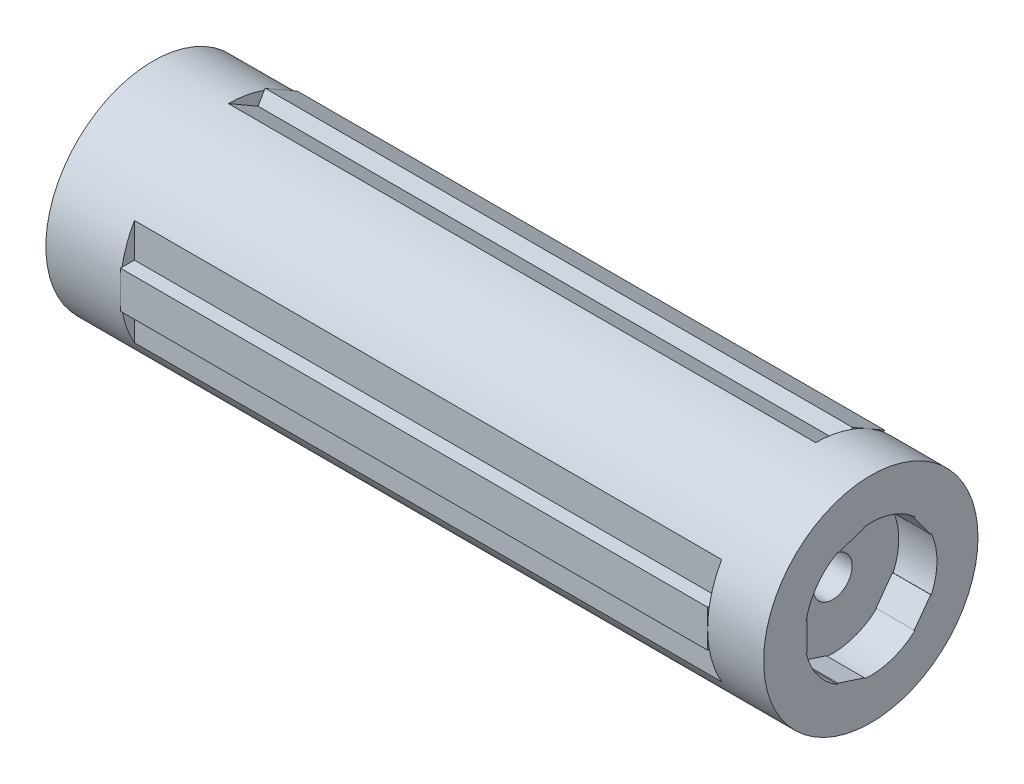
from build123d import *

# Parameters (mm, degrees)
SKIZZE1_R                       = 11.5
AUFSATZ_LINEAR_AUSTRAGEN1_DEPTH = 77
SCHNITT_LINEAR_AUSTRAGEN1_DEPTH = 4.1
SKIZZE3_R                       = 2.1
SCHNITT_LINEAR_AUSTRAGEN2_DEPTH = 3
SKIZZE4_R                       = 9.6
SCHNITT_LINEAR_AUSTRAGEN3_DEPTH = 12.75
SCHNITT_LINEAR_START            = -6
SKIZZE7_W                       = 1.5
SKIZZE7_H                       = 15
SCHNITT_LINEAR_AUSTRAGEN4_DEPTH = 63
SKIZZE8_W                       = 63
SKIZZE8_H                       = 4
AUFSATZ_LINEAR_AUSTRAGEN2_DEPTH = 1.5
SCHNITT_LINEAR_AUSTRAGEN6_DEPTH = 13.5
SKIZZE12_R                      = 3
SCHNITT_LINEAR_AUSTRAGEN7_DEPTH = 2
KREISMUSTER3_COUNT              = 3
SKIZZE13_R                      = 8.5
SCHNITT_LINEAR_AUSTRAGEN8_DEPTH = 40


with BuildPart() as part:
    # Skizze1 → Aufsatz-Linear austragen1 (new body)
    with BuildSketch(Plane(origin=(0, 0, 0), x_dir=(0, 0, -1), z_dir=(1, 0, 0))):
        Circle(SKIZZE1_R)
    extrude(amount=AUFSATZ_LINEAR_AUSTRAGEN1_DEPTH)

    # Skizze2 → Schnitt-Linear austragen1 (cut)
    with BuildSketch(Plane(origin=(77, 0, 0), x_dir=(0, 0, -1), z_dir=(1, 0, 0))):
        with BuildLine():
            Line((-6.942668977, 1.486387391), (-6.842668977, 1.486387391))
            Line((-6.842668977, 1.486387391), (-6.842668977, -1.513612609))
            Line((-6.842668977, -1.513612609), (-6.936784332, -1.513612609))
            ThreePointArc((-6.936784332, -1.513612609), (-5.735823545, -4.184534414), (-3.559041115, -6.143551607))
            Line((-3.559041115, -6.143551607), (-3.528139415, -6.048445955))
            Line((-3.528139415, -6.048445955), (-0.674969866, -6.975496938))
            Line((-0.674969866, -6.975496938), (-0.70405311, -7.06500596))
            ThreePointArc((-0.70405311, -7.06500596), (2.207261771, -6.748184606), (4.743060601, -5.283311096))
            Line((4.743060601, -5.283311096), (4.662158901, -5.224532571))
            Line((4.662158901, -5.224532571), (6.425514658, -2.797481588))
            Line((6.425514658, -2.797481588), (6.50165558, -2.852801206))
            ThreePointArc((6.50165558, -2.852801206), (7.099986341, 0.013926966), (6.490413777, 2.878285776))
            Line((6.490413777, 2.878285776), (6.409512077, 2.819507251))
            Line((6.409512077, 2.819507251), (4.64615632, 5.246558234))
            Line((4.64615632, 5.246558234), (4.722297242, 5.301877852))
            ThreePointArc((4.722297242, 5.301877852), (2.180771108, 6.756791944), (-0.731764286, 7.062189535))
            Line((-0.731764286, 7.062189535), (-0.700862586, 6.967083883))
            Line((-0.700862586, 6.967083883), (-3.554032135, 6.0400329))
            Line((-3.554032135, 6.0400329), (-3.583115379, 6.129541922))
            ThreePointArc((-3.583115379, 6.129541922), (-5.752195675, 4.162000111), (-6.942668977, 1.486387391))
        make_face()
    extrude(amount=-SCHNITT_LINEAR_AUSTRAGEN1_DEPTH, mode=Mode.SUBTRACT)

    # Skizze3 → Schnitt-Linear austragen2 (cut)
    with BuildSketch(Plane(origin=(72.9, 0, 0), x_dir=(0, 0, -1), z_dir=(1, 0, 0))):
        Circle(SKIZZE3_R)
    extrude(amount=-SCHNITT_LINEAR_AUSTRAGEN2_DEPTH, mode=Mode.SUBTRACT)

    # Skizze4 → Schnitt-Linear austragen3 (cut)
    with BuildSketch(Plane.ZY):
        Circle(SKIZZE4_R)
    extrude(amount=-SCHNITT_LINEAR_AUSTRAGEN3_DEPTH, mode=Mode.SUBTRACT)

    # Skizze7 → Schnitt-Linear austragen4 (cut)
    with BuildSketch(Plane(origin=(77, 0, 0), x_dir=(0, 0, -1), z_dir=(1, 0, 0)).offset(SCHNITT_LINEAR_START)):
        with Locations((-10.75, 0)):
            Rectangle(SKIZZE7_W, SKIZZE7_H)
    schnitt_linear_austragen4 = extrude(amount=-SCHNITT_LINEAR_AUSTRAGEN4_DEPTH, mode=Mode.SUBTRACT)

    # Skizze8 → Aufsatz-Linear austragen2 (add)
    with BuildSketch(Plane.XY.offset(10)):
        with Locations((39.5, 0)):
            Rectangle(SKIZZE8_W, SKIZZE8_H)
    aufsatz_linear_austragen2 = extrude(amount=AUFSATZ_LINEAR_AUSTRAGEN2_DEPTH)

    # Skizze10 → Schnitt-Linear austragen6 (cut)
    with BuildSketch(Plane.ZY.offset(-12.75)):
        Polygon((4.038863706, -2.240739453), (3.959969143, 2.377388845), (-0.078894563, 4.618128298), (-4.038863706, 2.240739453), (-3.959969143, -2.377388845), (0.078894563, -4.618128298), align=None)
    extrude(amount=-SCHNITT_LINEAR_AUSTRAGEN6_DEPTH, mode=Mode.SUBTRACT)

    # Skizze12 → Schnitt-Linear austragen7 (cut)
    with BuildSketch(Plane.ZY.offset(-26.25)):
        Circle(SKIZZE12_R)
    extrude(amount=-SCHNITT_LINEAR_AUSTRAGEN7_DEPTH, mode=Mode.SUBTRACT)

    # Kreismuster3: Schnitt-Linear austragen4, Aufsatz-Linear austragen2 ×3 about axis
    kreismuster3_axis = Axis((0, 0, 0), (1, 0, 0))
    add([schnitt_linear_austragen4.rotate(kreismuster3_axis, i * 360 / KREISMUSTER3_COUNT) for i in range(1, KREISMUSTER3_COUNT)], mode=Mode.SUBTRACT)
    add([aufsatz_linear_austragen2.rotate(kreismuster3_axis, i * 360 / KREISMUSTER3_COUNT) for i in range(1, KREISMUSTER3_COUNT)])

    # Skizze13 → Schnitt-Linear austragen8 (cut)
    with BuildSketch(Plane(origin=(69.9, 0, 0), x_dir=(0, 0, -1), z_dir=(1, 0, 0))):
        Circle(SKIZZE13_R)
    extrude(amount=-SCHNITT_LINEAR_AUSTRAGEN8_DEPTH, mode=Mode.SUBTRACT)


solid = part.part
